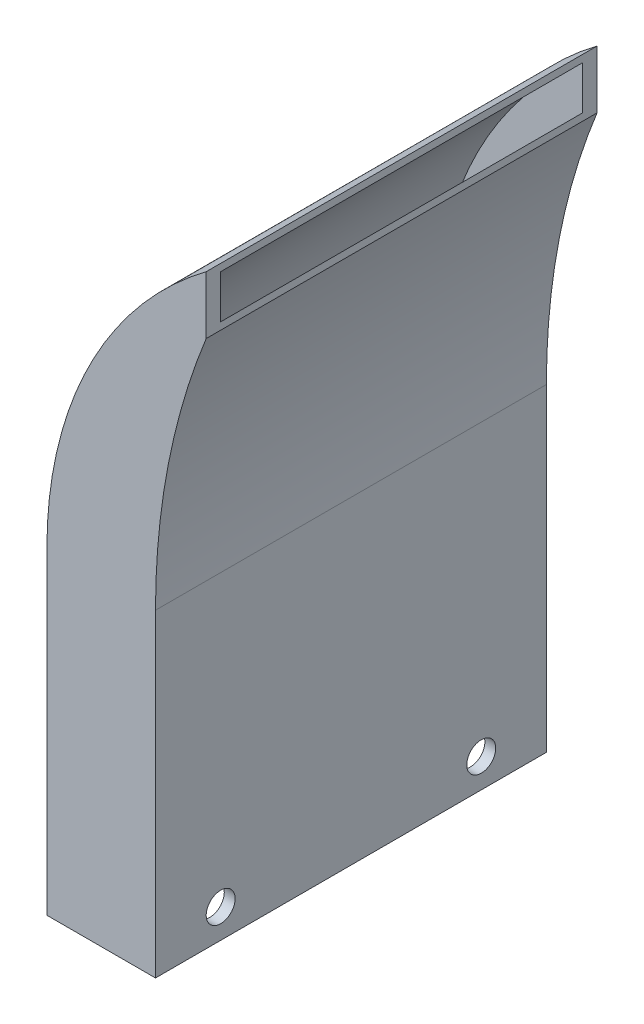
from build123d import *

# Parameters (mm, degrees)
BOSS_EXTRUDE1_DEPTH   = 27
BOSS_EXTRUDE1_2_DEPTH = 27
BOSS_EXTRUDE2_START   = -1
BOSS_EXTRUDE2_DEPTH   = 1
BOSS_EXTRUDE3_DEPTH   = 1
SKETCH4_R             = 1
CUT_EXTRUDE1_DEPTH    = 15


with BuildPart() as part:
    # Sketch1 → Boss-Extrude1 (new body)
    with BuildSketch(Plane.XY):
        with BuildLine():
            Line((-11, 0), (-11, 22))
            ThreePointArc((-11, 22), (-8.096747752, 34.298373876), (0, 44))
            Line((0, 44), (0, 43.5))
            ThreePointArc((0, 43.5), (-7.556411695, 33.909161389), (-10.25, 22))
            Line((-10.25, 22), (-10.25, 0))
            Line((-10.25, 0), (-11, 0))
        make_face()
    extrude(amount=BOSS_EXTRUDE1_DEPTH)



with BuildPart() as body_2:
    # Sketch1 → Boss-Extrude1 2 (new body)
    with BuildSketch(Plane.XY):
        with BuildLine():
            Line((-3.5, 0), (-3.5, 22))
            ThreePointArc((-3.5, 22), (-2.616882111, 31.16856041), (0, 40))
            Line((0, 40), (0, 40.5))
            ThreePointArc((0, 40.5), (-3.173839594, 31.490949636), (-4.25, 22))
            Line((-4.25, 22), (-4.25, 0))
            Line((-4.25, 0), (-3.5, 0))
        make_face()
    extrude(amount=BOSS_EXTRUDE1_2_DEPTH)


with BuildPart() as part_1:
    add(part.part)

    add(body_2.part)  # Boss-Extrude2 merges body 2
    # Sketch2 → Boss-Extrude2 (add)
    with BuildSketch(Plane.XY.offset(27).offset(BOSS_EXTRUDE2_START)):
        with BuildLine():
            Line((-4.25, 0), (-10.25, 0))
            Line((-10.25, 0), (-10.25, 22))
            ThreePointArc((-10.25, 22), (-7.556411695, 33.909161389), (0, 43.5))
            Line((0, 43.5), (0, 40.5))
            ThreePointArc((0, 40.5), (-3.173839594, 31.490949636), (-4.25, 22))
            Line((-4.25, 22), (-4.25, 0))
        make_face()
    extrude(amount=BOSS_EXTRUDE2_DEPTH)

    # Sketch3 → Boss-Extrude3 (add)
    with BuildSketch(Plane(origin=(0, 0, 0), x_dir=(-1, 0, 0), z_dir=(0, 0, -1))):
        with BuildLine():
            Line((4.25, 0), (10.25, 0))
            Line((10.25, 0), (10.25, 22))
            ThreePointArc((10.25, 22), (7.556411695, 33.909161389), (0, 43.5))
            Line((0, 43.5), (0, 40.5))
            ThreePointArc((0, 40.5), (3.173839594, 31.490949636), (4.25, 22))
            Line((4.25, 22), (4.25, 0))
        make_face()
    extrude(amount=-BOSS_EXTRUDE3_DEPTH)

    # Sketch4 → Cut-Extrude1 (cut)
    with BuildSketch(Plane.ZY.offset(11)):
        with Locations((4.5, 2)):
            Circle(SKETCH4_R)
        with Locations((22.5, 2)):
            Circle(SKETCH4_R)
    extrude(amount=-CUT_EXTRUDE1_DEPTH, mode=Mode.SUBTRACT)


solid = part_1.part
